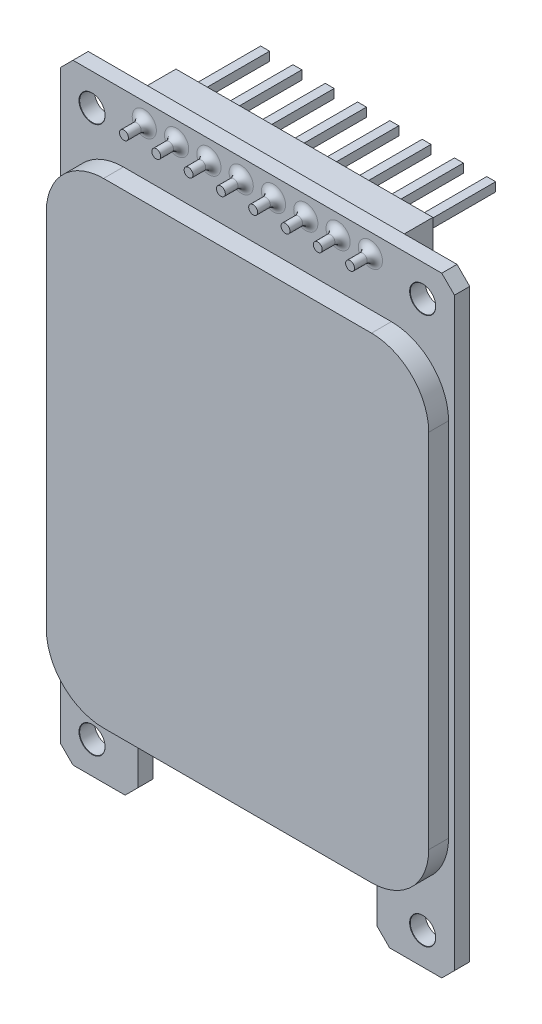
from build123d import *

# Parameters (mm, degrees)
AUFSATZ_LINEAR_AUSTRAGEN1_DEPTH          = 1.2
FASE1_SIZE                               = 1
F_2_0_2_DURCHMESSER_BOHRUNG1_D           = 2
F_2_0_2_DURCHMESSER_BOHRUNG1_CSINK_D     = 2.05
F_2_0_2_DURCHMESSER_BOHRUNG1_CSINK_ANGLE = 90
AUFSATZ_LINEAR_AUSTRAGEN2_DEPTH          = 1.56
AUFSATZ_LINEAR_AUSTRAGEN3_DEPTH          = 1.6
AUFSATZ_LINEAR_AUSTRAGEN3_DEPTH_BACK     = 9.7
SKIZZE5_R                                = 0.35
VERRUNDUNG1_R                            = 0.6
SKIZZE6_W                                = 20.2
SKIZZE6_H                                = 2.5
AUFSATZ_LINEAR_AUSTRAGEN4_DEPTH          = 2.5
SKIZZE7_W                                = 0.7
SKIZZE7_H                                = 0.7
AUFSATZ_LINEAR_AUSTRAGEN5_DEPTH          = 6
FASE2_SIZE                               = 0.2


with BuildPart() as part:
    # Skizze1 → Aufsatz-Linear austragen1 (new body)
    with BuildSketch(Plane(origin=(0, 0, 0), x_dir=(0, 1, 0), z_dir=(0, 0, 1))):
        Polygon((-24, 9.4), (-18.5, 9.4), (-18.5, -9.4), (-24, -9.4), (-24, -15.5), (24, -15.5), (24, 15.5), (-24, 15.5), align=None)
    extrude(amount=AUFSATZ_LINEAR_AUSTRAGEN1_DEPTH)

    # Fase1
    fase1_edges = [part.edges().sort_by_distance(p)[0] for p in [
        (15.5, 24, 0.6),
        (15.5, -24, 0.6),
        (9.4, -24, 0.6),
        (-9.4, -24, 0.6),
        (-15.5, -24, 0.6),
        (-15.5, 24, 0.6),
    ]]
    chamfer(fase1_edges, length=FASE1_SIZE)

    # Ø2.0 (2) Durchmesser Bohrung1 (through all)
    with Locations(Plane(origin=(0, 0, 1.2), x_dir=(0, -1, 0), z_dir=(0, 0, 1))):
        with Locations((21.5, 13), (-21.5, 13), (21.5, -13), (-21.5, -13)):
            CounterSinkHole(F_2_0_2_DURCHMESSER_BOHRUNG1_D / 2, F_2_0_2_DURCHMESSER_BOHRUNG1_CSINK_D / 2, counter_sink_angle=F_2_0_2_DURCHMESSER_BOHRUNG1_CSINK_ANGLE)

    # Skizze4 → Aufsatz-Linear austragen2 (add)
    with BuildSketch(Plane.XY.offset(1.2)):
        with BuildLine():
            Line((10.535, -18.715), (-10.535, -18.715))
            ThreePointArc((-10.535, -18.715), (-13.716980515, -17.396980515), (-15.035, -14.215))
            Line((-15.035, -14.215), (-15.035, 14.215))
            ThreePointArc((-15.035, 14.215), (-13.716980515, 17.396980515), (-10.535, 18.715))
            Line((-10.535, 18.715), (10.535, 18.715))
            ThreePointArc((10.535, 18.715), (13.716980515, 17.396980515), (15.035, 14.215))
            Line((15.035, 14.215), (15.035, -14.215))
            ThreePointArc((15.035, -14.215), (13.716980515, -17.396980515), (10.535, -18.715))
        make_face()
    extrude(amount=AUFSATZ_LINEAR_AUSTRAGEN2_DEPTH)

    # Skizze5 → Aufsatz-Linear austragen3 (add, two sides: drawn at the far end of the back side and taken through both)
    with BuildSketch(Plane.XY.offset(1.2).offset(-AUFSATZ_LINEAR_AUSTRAGEN3_DEPTH_BACK)):
        with Locations((-8.89, 22.5)):
            Circle(SKIZZE5_R)
        with Locations((-6.35, 22.5)):
            Circle(SKIZZE5_R)
        with Locations((-3.81, 22.5)):
            Circle(SKIZZE5_R)
        with Locations((-1.27, 22.5)):
            Circle(SKIZZE5_R)
        with Locations((1.27, 22.5)):
            Circle(SKIZZE5_R)
        with Locations((3.81, 22.5)):
            Circle(SKIZZE5_R)
        with Locations((6.35, 22.5)):
            Circle(SKIZZE5_R)
        with Locations((8.89, 22.5)):
            Circle(SKIZZE5_R)
    extrude(amount=AUFSATZ_LINEAR_AUSTRAGEN3_DEPTH + AUFSATZ_LINEAR_AUSTRAGEN3_DEPTH_BACK)

    # Verrundung1
    verrundung1_edges = [part.edges().sort_by_distance(p)[0] for p in [
        (-9.24, 22.5, 1.2),
        (-6.7, 22.5, 1.2),
        (-4.16, 22.5, 1.2),
        (-1.62, 22.5, 1.2),
        (0.92, 22.5, 1.2),
        (3.46, 22.5, 1.2),
        (6, 22.5, 1.2),
        (8.54, 22.5, 1.2),
    ]]
    fillet(verrundung1_edges, radius=VERRUNDUNG1_R)

    # Skizze6 → Aufsatz-Linear austragen4 (add)
    with BuildSketch(Plane(origin=(0, 0, 0), x_dir=(1, 0, 0), z_dir=(0, 0, -1))):
        with Locations((0, -22.5)):
            Rectangle(SKIZZE6_W, SKIZZE6_H)
    extrude(amount=AUFSATZ_LINEAR_AUSTRAGEN4_DEPTH)

    # Skizze7 → Aufsatz-Linear austragen5 (add)
    with BuildSketch(Plane(origin=(0, 0, -2.5), x_dir=(1, 0, 0), z_dir=(0, 0, -1))):
        with Locations((6.35, -22.5)):
            Rectangle(SKIZZE7_W, SKIZZE7_H)
        with Locations((8.89, -22.5)):
            Rectangle(SKIZZE7_W, SKIZZE7_H)
        with Locations((3.81, -22.5)):
            Rectangle(SKIZZE7_W, SKIZZE7_H)
        with Locations((1.27, -22.5)):
            Rectangle(SKIZZE7_W, SKIZZE7_H)
        with Locations((-1.27, -22.5)):
            Rectangle(SKIZZE7_W, SKIZZE7_H)
        with Locations((-3.81, -22.5)):
            Rectangle(SKIZZE7_W, SKIZZE7_H)
        with Locations((-6.35, -22.5)):
            Rectangle(SKIZZE7_W, SKIZZE7_H)
        with Locations((-8.89, -22.5)):
            Rectangle(SKIZZE7_W, SKIZZE7_H)
    extrude(amount=AUFSATZ_LINEAR_AUSTRAGEN5_DEPTH)

    # Fase2
    fase2_edges = [part.edges().sort_by_distance(p)[0] for p in [
        (8.89, 22.85, -8.5),
        (8.54, 22.5, -8.5),
        (8.89, 22.15, -8.5),
        (9.24, 22.5, -8.5),
        (6.35, 22.85, -8.5),
        (6, 22.5, -8.5),
        (6.35, 22.15, -8.5),
        (6.7, 22.5, -8.5),
        (3.81, 22.85, -8.5),
        (3.46, 22.5, -8.5),
        (3.81, 22.15, -8.5),
        (4.16, 22.5, -8.5),
        (1.27, 22.85, -8.5),
        (0.92, 22.5, -8.5),
        (1.27, 22.15, -8.5),
        (1.62, 22.5, -8.5),
        (-1.27, 22.85, -8.5),
        (-1.62, 22.5, -8.5),
        (-1.27, 22.15, -8.5),
        (-0.92, 22.5, -8.5),
        (-3.81, 22.85, -8.5),
        (-4.16, 22.5, -8.5),
        (-3.81, 22.15, -8.5),
        (-3.46, 22.5, -8.5),
        (-6.35, 22.85, -8.5),
        (-6.7, 22.5, -8.5),
        (-6.35, 22.15, -8.5),
        (-6, 22.5, -8.5),
        (-8.89, 22.85, -8.5),
        (-9.24, 22.5, -8.5),
        (-8.89, 22.15, -8.5),
        (-8.54, 22.5, -8.5),
    ]]
    chamfer(fase2_edges, length=FASE2_SIZE)


solid = part.part
